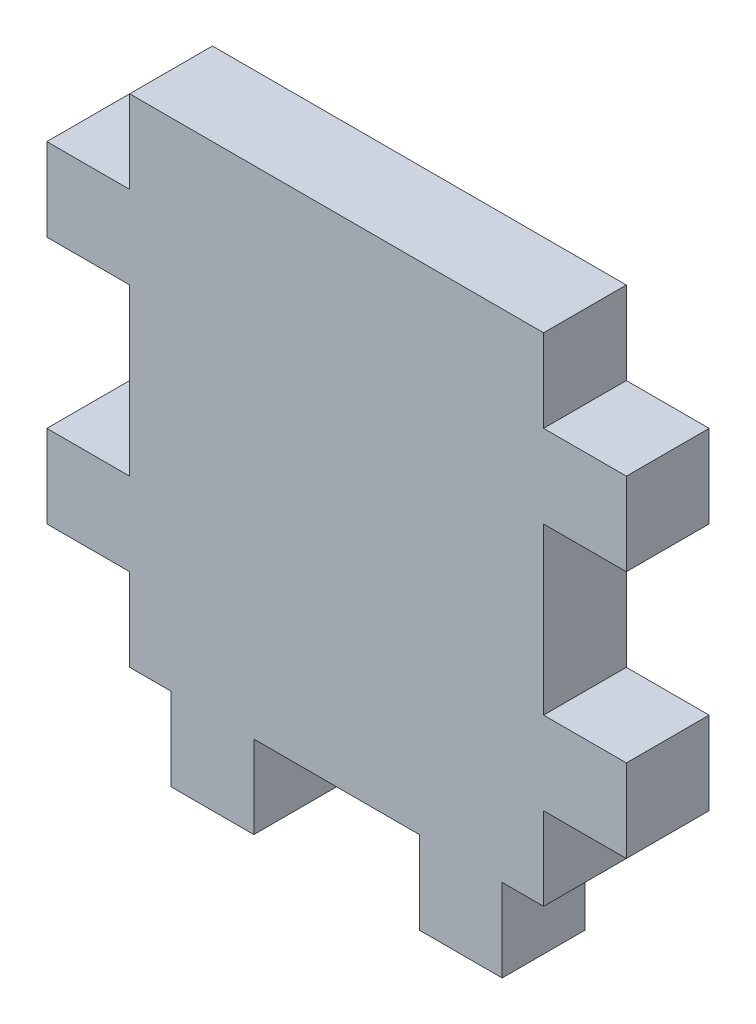
from build123d import *

# Parameters (mm, degrees)
BOSS_EXTRUDE1_DEPTH = 5


with BuildPart() as part:
    # Sketch1 → Boss-Extrude1 (new body)
    with BuildSketch(Plane.XY):
        Polygon((0, 0), (0, 5), (-2.5, 5), (-2.5, 10.000274966), (-7.5, 10.000274966), (-7.5, 15.000274966), (-2.5, 15.000274966), (-2.5, 25.000274966), (-7.5, 25.000274966), (-7.5, 30.000274966), (-2.5, 30.000274966), (-2.5, 35), (22.5, 35), (22.5, 30.000274966), (27.5, 30.000274966), (27.5, 25.000274966), (22.5, 25.000274966), (22.5, 15.000274966), (27.5, 15.000274966), (27.5, 10.000274966), (22.5, 10.000274966), (22.5, 5), (20, 5), (20, 0), (15, 0), (15, 5), (5, 5), (5, 0), align=None)
    extrude(amount=BOSS_EXTRUDE1_DEPTH)


solid = part.part
